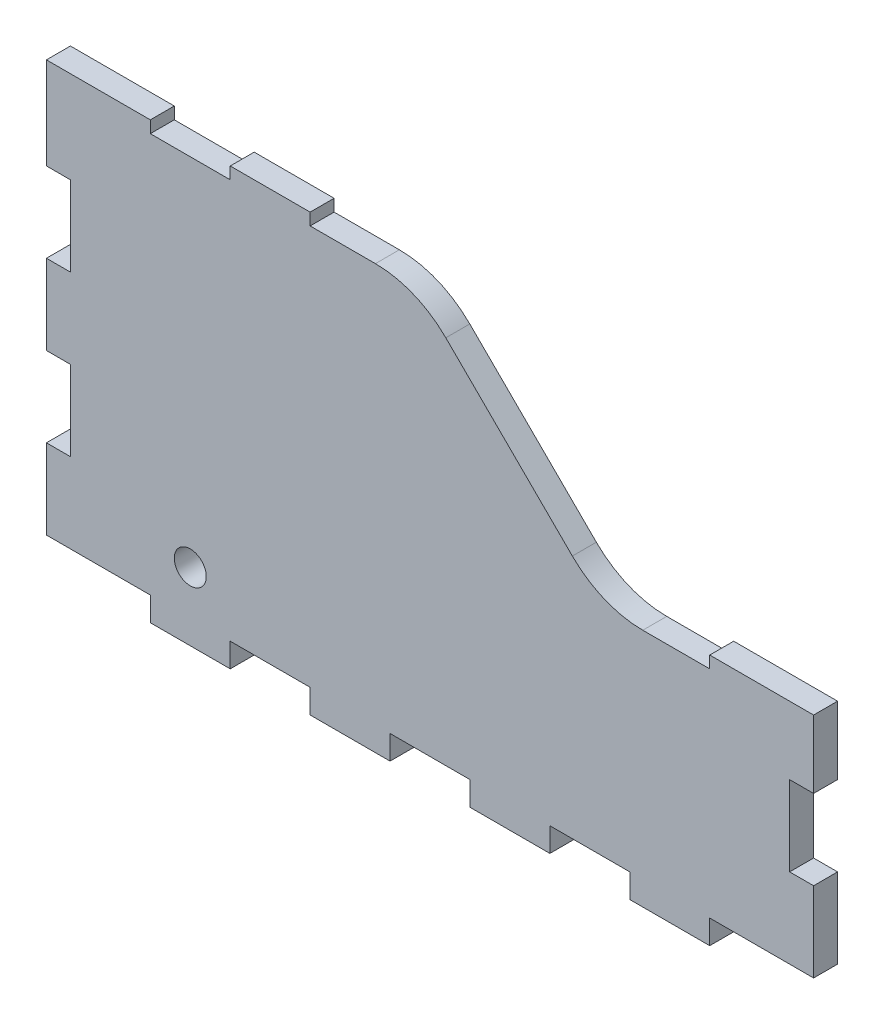
from build123d import *

# Parameters (mm, degrees)
SKETCH1_R           = 4
BOSS_EXTRUDE1_DEPTH = 6


with BuildPart() as part:
    # Sketch1 → Boss-Extrude1 (new body)
    with BuildSketch(Plane.XY):
        with BuildLine():
            Line((-95.354884471, 28.444147702), (-95.354884471, 8.444147702))
            Line((-95.354884471, 8.444147702), (-101.354884471, 8.444147702))
            Line((-101.354884471, 8.444147702), (-101.354884471, -11.555852298))
            Line((-101.354884471, -11.555852298), (-95.354884471, -11.555852298))
            Line((-95.354884471, -11.555852298), (-95.354884471, -31.555852298))
            Line((-95.354884471, -31.555852298), (-101.354884471, -31.555852298))
            Line((-101.354884471, -31.555852298), (-101.354884471, -51.555852298))
            Line((-101.354884471, -51.555852298), (-75.354884471, -51.555852298))
            Line((-75.354884471, -51.555852298), (-75.354884471, -57.555852298))
            Line((-75.354884471, -57.555852298), (-55.354884471, -57.555852298))
            Line((-55.354884471, -57.555852298), (-55.354884471, -51.555852298))
            Line((-55.354884471, -51.555852298), (-35.354884471, -51.555852298))
            Line((-35.354884471, -51.555852298), (-35.354884471, -57.555852298))
            Line((-35.354884471, -57.555852298), (-15.354884471, -57.555852298))
            Line((-15.354884471, -57.555852298), (-15.354884471, -51.555852298))
            Line((-15.354884471, -51.555852298), (4.645115529, -51.555852298))
            Line((4.645115529, -51.555852298), (4.645115529, -57.555852298))
            Line((4.645115529, -57.555852298), (24.645115529, -57.555852298))
            Line((24.645115529, -57.555852298), (24.645115529, -51.555852298))
            Line((24.645115529, -51.555852298), (44.645115529, -51.555852298))
            Line((44.645115529, -51.555852298), (44.645115529, -57.555852298))
            Line((44.645115529, -57.555852298), (64.645115529, -57.555852298))
            Line((64.645115529, -57.555852298), (64.645115529, -51.555852298))
            Line((64.645115529, -51.555852298), (90.645115529, -51.555852298))
            Line((90.645115529, -51.555852298), (90.645115529, -31.555852298))
            Line((90.645115529, -31.555852298), (84.645115529, -31.555852298))
            Line((84.645115529, -31.555852298), (84.645115529, -11.555852298))
            Line((84.645115529, -11.555852298), (90.645115529, -11.555852298))
            Line((90.645115529, -11.555852298), (90.645115529, 5.444147702))
            Line((90.645115529, 5.444147702), (64.645115529, 5.444147702))
            Line((64.645115529, 5.444147702), (64.645115529, 2.444147702))
            Line((64.645115529, 2.444147702), (47.89113696, 2.444147702))
            ThreePointArc((47.89113696, 2.444147702), (38.36080563, 4.331969424), (30.269799621, 9.710324922))
            Line((30.269799621, 9.710324922), (-1.398719, 41.177970481))
            ThreePointArc((-1.398719, 41.177970481), (-9.48972501, 46.55632598), (-19.020056339, 48.444147702))
            Line((-19.020056339, 48.444147702), (-35.354884471, 48.444147702))
            Line((-35.354884471, 48.444147702), (-35.354884471, 51.444147702))
            Line((-35.354884471, 51.444147702), (-55.354884471, 51.444147702))
            Line((-55.354884471, 51.444147702), (-55.354884471, 48.444147702))
            Line((-55.354884471, 48.444147702), (-75.354884471, 48.444147702))
            Line((-75.354884471, 48.444147702), (-75.354884471, 51.444147702))
            Line((-75.354884471, 51.444147702), (-101.354884471, 51.444147702))
            Line((-101.354884471, 51.444147702), (-101.354884471, 28.444147702))
            Line((-101.354884471, 28.444147702), (-95.354884471, 28.444147702))
        make_face()
        with Locations((-65.354884471, -40.555852298)):
            Circle(SKETCH1_R, mode=Mode.SUBTRACT)
    extrude(amount=BOSS_EXTRUDE1_DEPTH)


solid = part.part
